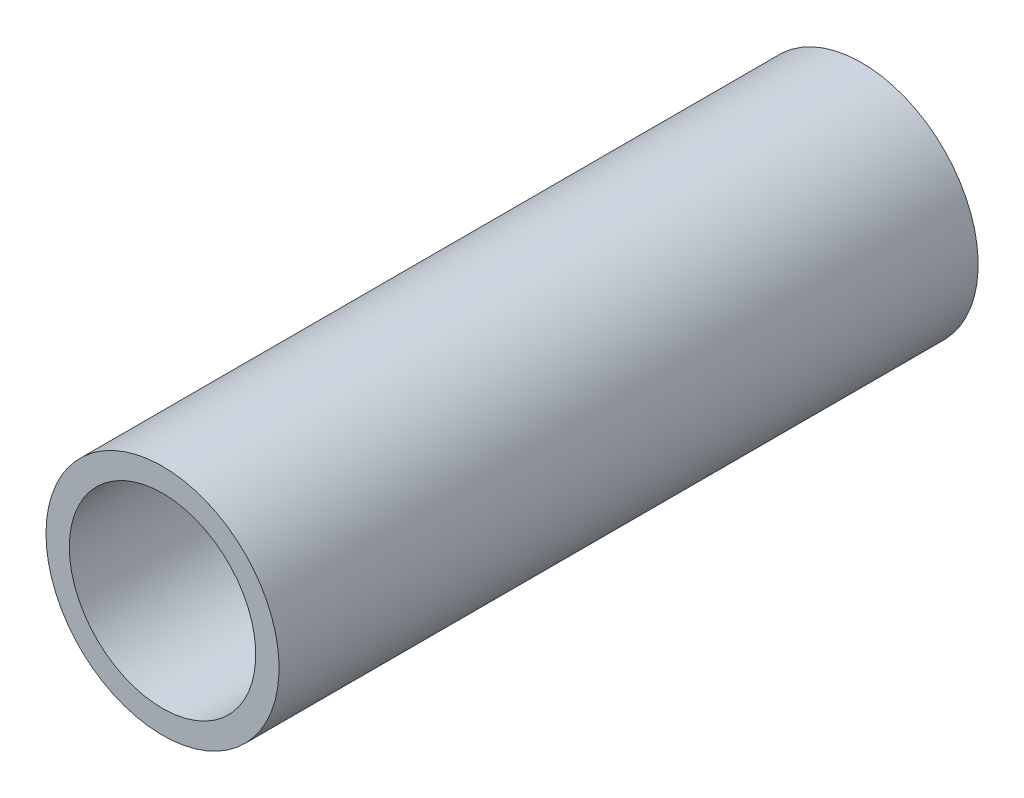
from build123d import *

# Parameters (mm, degrees)
SKETCH1_R           = 7.5
SKETCH1_R_2         = 6
BOSS_EXTRUDE1_DEPTH = 45


with BuildPart() as part:
    # Sketch1 → Boss-Extrude1 (new body)
    with BuildSketch(Plane.XY):
        with Locations(Location((0, 0, 0), (0, 0, 180))):
            Circle(SKETCH1_R)
        with Locations(Location((0, 0, 0), (0, 0, 180))):
            Circle(SKETCH1_R_2, mode=Mode.SUBTRACT)
    extrude(amount=BOSS_EXTRUDE1_DEPTH)


solid = part.part
